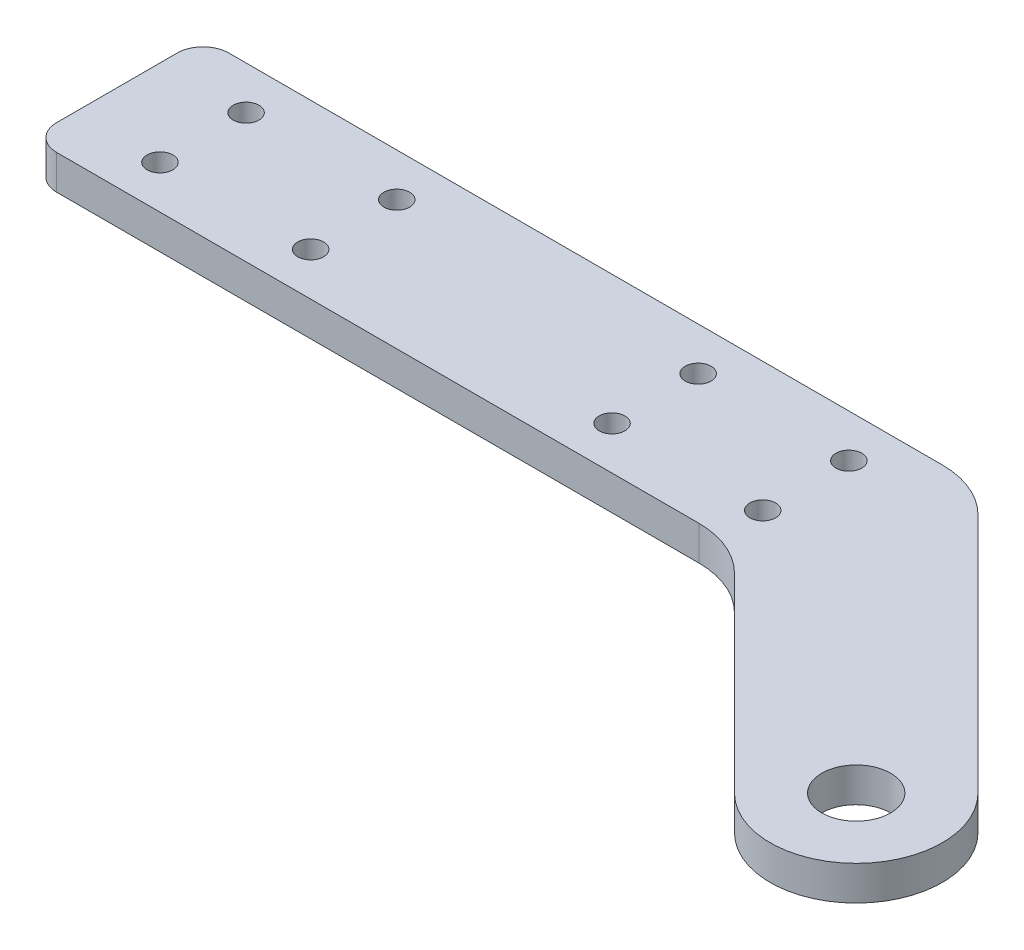
from build123d import *

# Parameters (mm, degrees)
SKETCH_1_R          = 4
EXTRUDE_1_DEPTH     = 4
CUT_EXTRUDE_1_REACH = 127.309
SKETCH_2_R          = 1.5
EXTRUDE_2_DEPTH     = 4
FILLET_1_R          = 3
FILLET_3_R          = 10
SKETCH_4_R          = 1.5
CUT_EXTRUDE_2_DEPTH = 10


with BuildPart() as part:
    # 草图1 → 凸台-拉伸1 (new body)
    with BuildSketch(Plane(origin=(0, 0, 0), x_dir=(1, 0, 0), z_dir=(0, 1, 0))):
        with BuildLine():
            Line((100.928932188, -30.928932188), (70, 0))
            Line((70, 0), (35, 0))
            Line((35, 0), (35, 70))
            Line((35, 70), (15, 70))
            Line((15, 70), (15, 0))
            Line((15, 0), (-20, 0))
            Line((-20, 0), (-20, -20))
            Line((-20, -20), (61.715728753, -20))
            Line((61.715728753, -20), (86.786796564, -45.071067812))
            ThreePointArc((86.786796564, -45.071067812), (100.928932188, -45.071067812), (100.928932188, -30.928932188))
        make_face()
        with Locations(Location((93.857864376, -38, 0), (0, 0, 270))):
            Circle(SKETCH_1_R, mode=Mode.SUBTRACT)
    extrude(amount=EXTRUDE_1_DEPTH)

    # 草图2 → 切除-拉伸1 (cut, up to next)
    with BuildSketch(Plane(origin=(0, 4, 0), x_dir=(1, 0, 0), z_dir=(0, 1, 0)), mode=Mode.PRIVATE) as cut_extrude_1_sk1:
        with Locations(Location((17.5, 60, 0), (0, 0, 270))):
            Circle(SKETCH_2_R)
    cut_extrude_1_tool1 = extrude(cut_extrude_1_sk1.sketch, amount=-CUT_EXTRUDE_1_REACH, mode=Mode.PRIVATE) & part.part
    # 草图2 → 切除-拉伸1 (cut, up to next)
    with BuildSketch(Plane(origin=(0, 4, 0), x_dir=(1, 0, 0), z_dir=(0, 1, 0)), mode=Mode.PRIVATE) as cut_extrude_1_sk2:
        with Locations(Location((32.5, 60, 0), (0, 0, 270))):
            Circle(SKETCH_2_R)
    cut_extrude_1_tool2 = extrude(cut_extrude_1_sk2.sketch, amount=-CUT_EXTRUDE_1_REACH, mode=Mode.PRIVATE) & part.part
    # 草图2 → 切除-拉伸1 (cut, up to next)
    with BuildSketch(Plane(origin=(0, 4, 0), x_dir=(1, 0, 0), z_dir=(0, 1, 0)), mode=Mode.PRIVATE) as cut_extrude_1_sk3:
        with Locations(Location((32.5, 50, 0), (0, 0, 270))):
            Circle(SKETCH_2_R)
    cut_extrude_1_tool3 = extrude(cut_extrude_1_sk3.sketch, amount=-CUT_EXTRUDE_1_REACH, mode=Mode.PRIVATE) & part.part
    # 草图2 → 切除-拉伸1 (cut, up to next)
    with BuildSketch(Plane(origin=(0, 4, 0), x_dir=(1, 0, 0), z_dir=(0, 1, 0)), mode=Mode.PRIVATE) as cut_extrude_1_sk4:
        with Locations(Location((17.5, 50, 0), (0, 0, 270))):
            Circle(SKETCH_2_R)
    cut_extrude_1_tool4 = extrude(cut_extrude_1_sk4.sketch, amount=-CUT_EXTRUDE_1_REACH, mode=Mode.PRIVATE) & part.part
    # 草图2 → 切除-拉伸1 (cut, up to next)
    with BuildSketch(Plane(origin=(0, 4, 0), x_dir=(1, 0, 0), z_dir=(0, 1, 0)), mode=Mode.PRIVATE) as cut_extrude_1_sk5:
        with Locations(Location((17.5, 20, 0), (0, 0, 270))):
            Circle(SKETCH_2_R)
    cut_extrude_1_tool5 = extrude(cut_extrude_1_sk5.sketch, amount=-CUT_EXTRUDE_1_REACH, mode=Mode.PRIVATE) & part.part
    # 草图2 → 切除-拉伸1 (cut, up to next)
    with BuildSketch(Plane(origin=(0, 4, 0), x_dir=(1, 0, 0), z_dir=(0, 1, 0)), mode=Mode.PRIVATE) as cut_extrude_1_sk6:
        with Locations(Location((17.5, 10, 0), (0, 0, 270))):
            Circle(SKETCH_2_R)
    cut_extrude_1_tool6 = extrude(cut_extrude_1_sk6.sketch, amount=-CUT_EXTRUDE_1_REACH, mode=Mode.PRIVATE) & part.part
    # 草图2 → 切除-拉伸1 (cut, up to next)
    with BuildSketch(Plane(origin=(0, 4, 0), x_dir=(1, 0, 0), z_dir=(0, 1, 0)), mode=Mode.PRIVATE) as cut_extrude_1_sk7:
        with Locations(Location((32.5, 10, 0), (0, 0, 270))):
            Circle(SKETCH_2_R)
    cut_extrude_1_tool7 = extrude(cut_extrude_1_sk7.sketch, amount=-CUT_EXTRUDE_1_REACH, mode=Mode.PRIVATE) & part.part
    # 草图2 → 切除-拉伸1 (cut, up to next)
    with BuildSketch(Plane(origin=(0, 4, 0), x_dir=(1, 0, 0), z_dir=(0, 1, 0)), mode=Mode.PRIVATE) as cut_extrude_1_sk8:
        with Locations(Location((32.5, 20, 0), (0, 0, 270))):
            Circle(SKETCH_2_R)
    cut_extrude_1_tool8 = extrude(cut_extrude_1_sk8.sketch, amount=-CUT_EXTRUDE_1_REACH, mode=Mode.PRIVATE) & part.part
    # 草图2 → 切除-拉伸1 (cut, up to next)
    with BuildSketch(Plane(origin=(0, 4, 0), x_dir=(1, 0, 0), z_dir=(0, 1, 0)), mode=Mode.PRIVATE) as cut_extrude_1_sk9:
        with Locations(Location((42.5, -5, 0), (0, 0, 270))):
            Circle(SKETCH_2_R)
    cut_extrude_1_tool9 = extrude(cut_extrude_1_sk9.sketch, amount=-CUT_EXTRUDE_1_REACH, mode=Mode.PRIVATE) & part.part
    # 草图2 → 切除-拉伸1 (cut, up to next)
    with BuildSketch(Plane(origin=(0, 4, 0), x_dir=(1, 0, 0), z_dir=(0, 1, 0)), mode=Mode.PRIVATE) as cut_extrude_1_sk10:
        with Locations(Location((42.5, -15, 0), (0, 0, 270))):
            Circle(SKETCH_2_R)
    cut_extrude_1_tool10 = extrude(cut_extrude_1_sk10.sketch, amount=-CUT_EXTRUDE_1_REACH, mode=Mode.PRIVATE) & part.part
    # 草图2 → 切除-拉伸1 (cut, up to next)
    with BuildSketch(Plane(origin=(0, 4, 0), x_dir=(1, 0, 0), z_dir=(0, 1, 0)), mode=Mode.PRIVATE) as cut_extrude_1_sk11:
        with Locations(Location((7.5, -15, 0), (0, 0, 270))):
            Circle(SKETCH_2_R)
    cut_extrude_1_tool11 = extrude(cut_extrude_1_sk11.sketch, amount=-CUT_EXTRUDE_1_REACH, mode=Mode.PRIVATE) & part.part
    # 草图2 → 切除-拉伸1 (cut, up to next)
    with BuildSketch(Plane(origin=(0, 4, 0), x_dir=(1, 0, 0), z_dir=(0, 1, 0)), mode=Mode.PRIVATE) as cut_extrude_1_sk12:
        with Locations(Location((7.5, -5, 0), (0, 0, 270))):
            Circle(SKETCH_2_R)
    cut_extrude_1_tool12 = extrude(cut_extrude_1_sk12.sketch, amount=-CUT_EXTRUDE_1_REACH, mode=Mode.PRIVATE) & part.part
    # 草图2 → 切除-拉伸1 (cut, up to next)
    with BuildSketch(Plane(origin=(0, 4, 0), x_dir=(1, 0, 0), z_dir=(0, 1, 0)), mode=Mode.PRIVATE) as cut_extrude_1_sk13:
        with Locations(Location((60, -15, 0), (0, 0, 270))):
            Circle(SKETCH_2_R)
    cut_extrude_1_tool13 = extrude(cut_extrude_1_sk13.sketch, amount=-CUT_EXTRUDE_1_REACH, mode=Mode.PRIVATE) & part.part
    # 草图2 → 切除-拉伸1 (cut, up to next)
    with BuildSketch(Plane(origin=(0, 4, 0), x_dir=(1, 0, 0), z_dir=(0, 1, 0)), mode=Mode.PRIVATE) as cut_extrude_1_sk14:
        with Locations(Location((60, -5, 0), (0, 0, 270))):
            Circle(SKETCH_2_R)
    cut_extrude_1_tool14 = extrude(cut_extrude_1_sk14.sketch, amount=-CUT_EXTRUDE_1_REACH, mode=Mode.PRIVATE) & part.part
    # 草图2 → 切除-拉伸1 (cut, up to next)
    with BuildSketch(Plane(origin=(0, 4, 0), x_dir=(1, 0, 0), z_dir=(0, 1, 0)), mode=Mode.PRIVATE) as cut_extrude_1_sk15:
        with Locations(Location((-10, -15, 0), (0, 0, 270))):
            Circle(SKETCH_2_R)
    cut_extrude_1_tool15 = extrude(cut_extrude_1_sk15.sketch, amount=-CUT_EXTRUDE_1_REACH, mode=Mode.PRIVATE) & part.part
    # 草图2 → 切除-拉伸1 (cut, up to next)
    with BuildSketch(Plane(origin=(0, 4, 0), x_dir=(1, 0, 0), z_dir=(0, 1, 0)), mode=Mode.PRIVATE) as cut_extrude_1_sk16:
        with Locations(Location((-10, -5, 0), (0, 0, 270))):
            Circle(SKETCH_2_R)
    cut_extrude_1_tool16 = extrude(cut_extrude_1_sk16.sketch, amount=-CUT_EXTRUDE_1_REACH, mode=Mode.PRIVATE) & part.part
    add(cut_extrude_1_tool1.solids().sort_by_distance((17.5, 4, -60))[0], mode=Mode.SUBTRACT)
    add(cut_extrude_1_tool2.solids().sort_by_distance((32.5, 4, -60))[0], mode=Mode.SUBTRACT)
    add(cut_extrude_1_tool3.solids().sort_by_distance((32.5, 4, -50))[0], mode=Mode.SUBTRACT)
    add(cut_extrude_1_tool4.solids().sort_by_distance((17.5, 4, -50))[0], mode=Mode.SUBTRACT)
    add(cut_extrude_1_tool5.solids().sort_by_distance((17.5, 4, -20))[0], mode=Mode.SUBTRACT)
    add(cut_extrude_1_tool6.solids().sort_by_distance((17.5, 4, -10))[0], mode=Mode.SUBTRACT)
    add(cut_extrude_1_tool7.solids().sort_by_distance((32.5, 4, -10))[0], mode=Mode.SUBTRACT)
    add(cut_extrude_1_tool8.solids().sort_by_distance((32.5, 4, -20))[0], mode=Mode.SUBTRACT)
    add(cut_extrude_1_tool9.solids().sort_by_distance((42.5, 4, 5))[0], mode=Mode.SUBTRACT)
    add(cut_extrude_1_tool10.solids().sort_by_distance((42.5, 4, 15))[0], mode=Mode.SUBTRACT)
    add(cut_extrude_1_tool11.solids().sort_by_distance((7.5, 4, 15))[0], mode=Mode.SUBTRACT)
    add(cut_extrude_1_tool12.solids().sort_by_distance((7.5, 4, 5))[0], mode=Mode.SUBTRACT)
    add(cut_extrude_1_tool13.solids().sort_by_distance((60, 4, 15))[0], mode=Mode.SUBTRACT)
    add(cut_extrude_1_tool14.solids().sort_by_distance((60, 4, 5))[0], mode=Mode.SUBTRACT)
    add(cut_extrude_1_tool15.solids().sort_by_distance((-10, 4, 15))[0], mode=Mode.SUBTRACT)
    add(cut_extrude_1_tool16.solids().sort_by_distance((-10, 4, 5))[0], mode=Mode.SUBTRACT)

    # 草图3 → 凸台-拉伸2 (add)
    with BuildSketch(Plane(origin=(0, 4, 0), x_dir=(1, 0, 0), z_dir=(0, 1, 0))):
        Polygon((50, 0), (35, 0), (35, 20), align=None)
        Polygon((15, 0), (0, 0), (15, 20), align=None)
    extrude(amount=-EXTRUDE_2_DEPTH)

    # 圆角1
    fillet_1_edges = [part.edges().sort_by_distance(p)[0] for p in [
        (35, 2, -20),
        (50, 2, 0),
        (15, 2, -20),
        (0, 2, 0),
        (-20, 2, 20),
        (-20, 2, 0),
        (15, 2, -70),
        (35, 2, -70),
    ]]
    fillet(fillet_1_edges, radius=FILLET_1_R)

    # 圆角3
    fillet_3_edges = [part.edges().sort_by_distance(p)[0] for p in [
        (61.715728753, 2, 20),
        (70, 2, 0),
    ]]
    fillet(fillet_3_edges, radius=FILLET_3_R)

    # 草图4 → 切除-拉伸2 (cut)
    with BuildSketch(Plane(origin=(0, 4, 0), x_dir=(1, 0, 0), z_dir=(0, 1, 0))):
        with BuildLine():
            Line((-1.5, 0), (51.5, 0))
            ThreePointArc((51.5, 0), (50.158359214, 0.316718427), (49.1, 1.2))
            Line((49.1, 1.2), (35.6, 19.2))
            ThreePointArc((35.6, 19.2), (35.153950106, 20.051316702), (35, 21))
            Line((35, 21), (35, 67))
            ThreePointArc((35, 67), (34.121320344, 69.121320344), (32, 70))
            Line((32, 70), (18, 70))
            ThreePointArc((18, 70), (15.878679656, 69.121320344), (15, 67))
            Line((15, 67), (15, 21))
            ThreePointArc((15, 21), (14.846049894, 20.051316702), (14.4, 19.2))
            Line((14.4, 19.2), (0.9, 1.2))
            ThreePointArc((0.9, 1.2), (-0.158359214, 0.316718427), (-1.5, 0))
        make_face()
        with Locations((32.5, 10)):
            Circle(SKETCH_4_R, mode=Mode.SUBTRACT)
        with Locations((17.5, 20)):
            Circle(SKETCH_4_R, mode=Mode.SUBTRACT)
        with Locations((32.5, 60)):
            Circle(SKETCH_4_R, mode=Mode.SUBTRACT)
        with Locations((17.5, 50)):
            Circle(SKETCH_4_R, mode=Mode.SUBTRACT)
        with Locations((17.5, 60)):
            Circle(SKETCH_4_R, mode=Mode.SUBTRACT)
        with Locations((32.5, 50)):
            Circle(SKETCH_4_R, mode=Mode.SUBTRACT)
        with Locations((32.5, 20)):
            Circle(SKETCH_4_R, mode=Mode.SUBTRACT)
        with Locations((17.5, 10)):
            Circle(SKETCH_4_R, mode=Mode.SUBTRACT)
    extrude(amount=-CUT_EXTRUDE_2_DEPTH, mode=Mode.SUBTRACT)


solid = part.part
